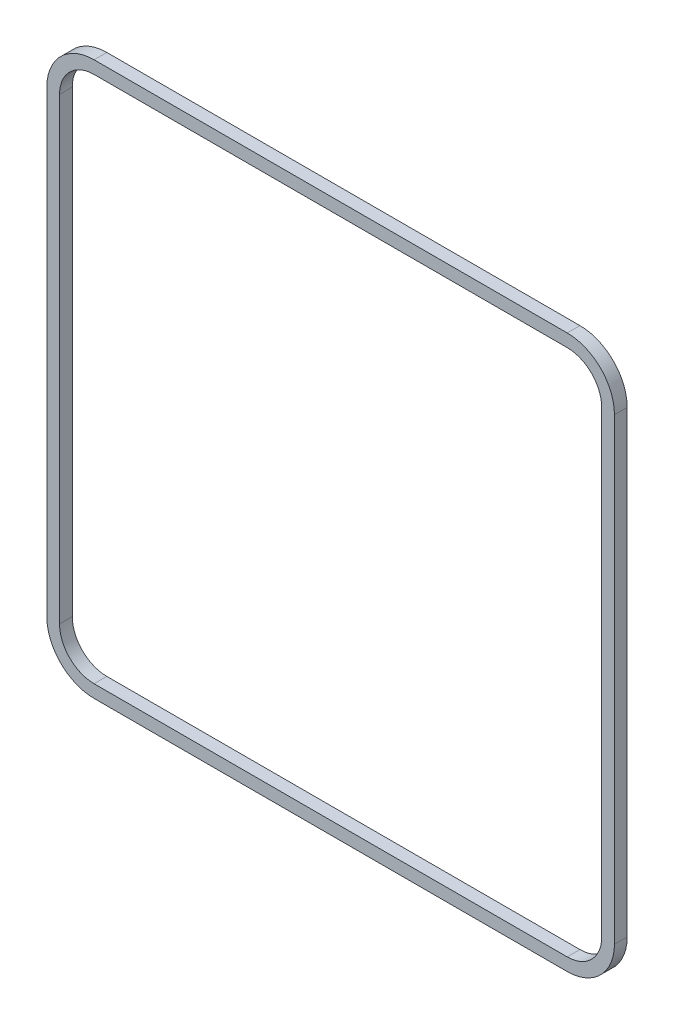
from build123d import *

# Parameters (mm, degrees)
BOSS_EXTRUDE1_DEPTH = 1.778


with BuildPart() as part:
    # Sketch1 → Boss-Extrude1 (new body)
    with BuildSketch(Plane.XY):
        with BuildLine():
            Line((-1.8415, 4.7625), (-1.8415, 68.8467))
            ThreePointArc((-1.8415, 68.8467), (0.092766817, 73.516433183), (4.7625, 75.4507))
            Line((4.7625, 75.4507), (70.8787, 75.4507))
            ThreePointArc((70.8787, 75.4507), (75.548433183, 73.516433183), (77.4827, 68.8467))
            Line((77.4827, 68.8467), (77.4827, 4.7625))
            ThreePointArc((77.4827, 4.7625), (75.548433183, 0.092766817), (70.8787, -1.8415))
            Line((70.8787, -1.8415), (4.7625, -1.8415))
            ThreePointArc((4.7625, -1.8415), (0.092766817, 0.092766817), (-1.8415, 4.7625))
        make_face()
        with BuildLine():
            Line((-0.0635, 4.7625), (-0.0635, 68.8467))
            ThreePointArc((-0.0635, 68.8467), (1.350002674, 72.259197326), (4.7625, 73.6727))
            Line((4.7625, 73.6727), (70.8787, 73.6727))
            ThreePointArc((70.8787, 73.6727), (74.291197326, 72.259197326), (75.7047, 68.8467))
            Line((75.7047, 68.8467), (75.7047, 4.7625))
            ThreePointArc((75.7047, 4.7625), (74.291197326, 1.350002674), (70.8787, -0.0635))
            Line((70.8787, -0.0635), (4.7625, -0.0635))
            ThreePointArc((4.7625, -0.0635), (1.350002674, 1.350002674), (-0.0635, 4.7625))
        make_face(mode=Mode.SUBTRACT)
    extrude(amount=BOSS_EXTRUDE1_DEPTH)


solid = part.part
